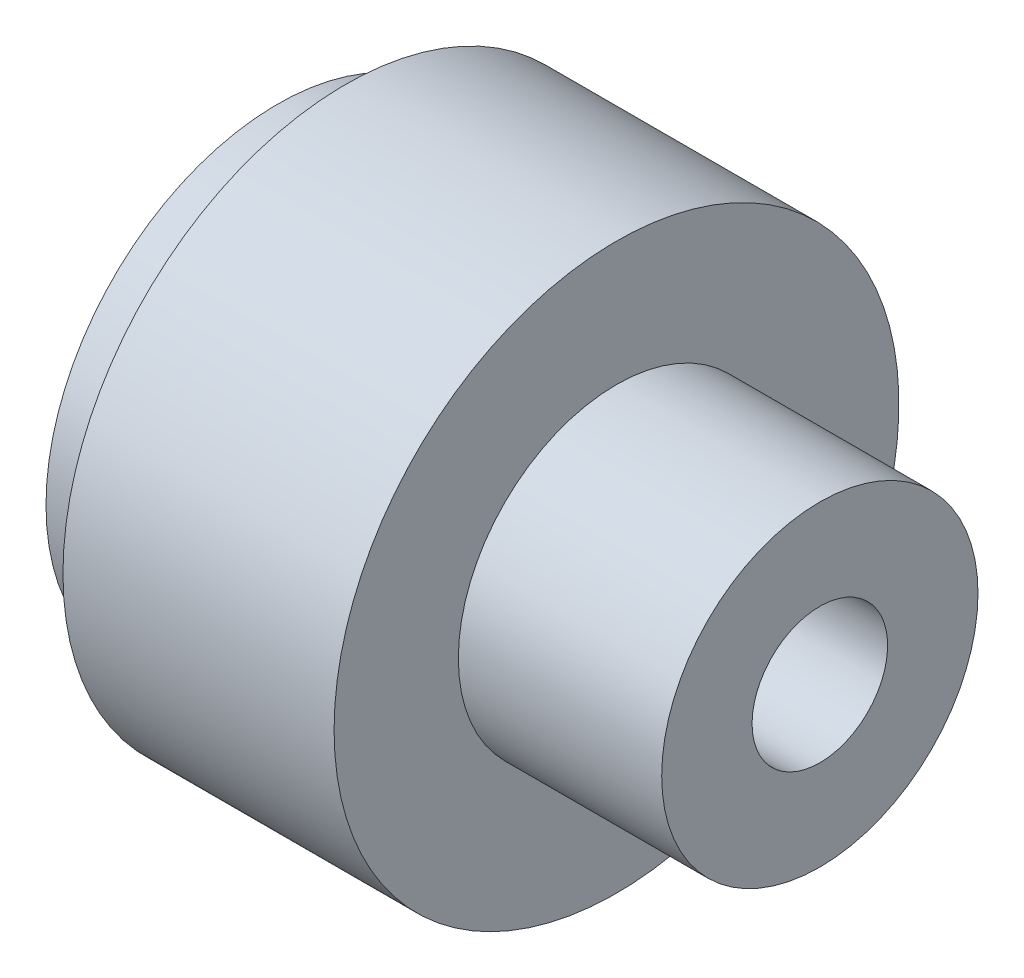
from build123d import *


with BuildPart() as part:
    # Esquisse1 → Révolution1 (revolve)
    with BuildSketch(Plane.XY, mode=Mode.PRIVATE) as r_volution1_sk:
        Polygon((-21, 8.330094596), (-24, 8.330094596), (-24, 13.330094596), (-21, 13.330094596), (-21, 15.580094596), (-9, 15.580094596), (-9, 10.080094596), (0, 10.080094596), (0, 6.080094596), (-21, 6.080094596), align=None)
    revolve(r_volution1_sk.sketch.rotate(Axis((-14.0625, 3.080094596, 0), (1, 0, 0)), 90), axis=Axis((-14.0625, 3.080094596, 0), (1, 0, 0)))


solid = part.part
